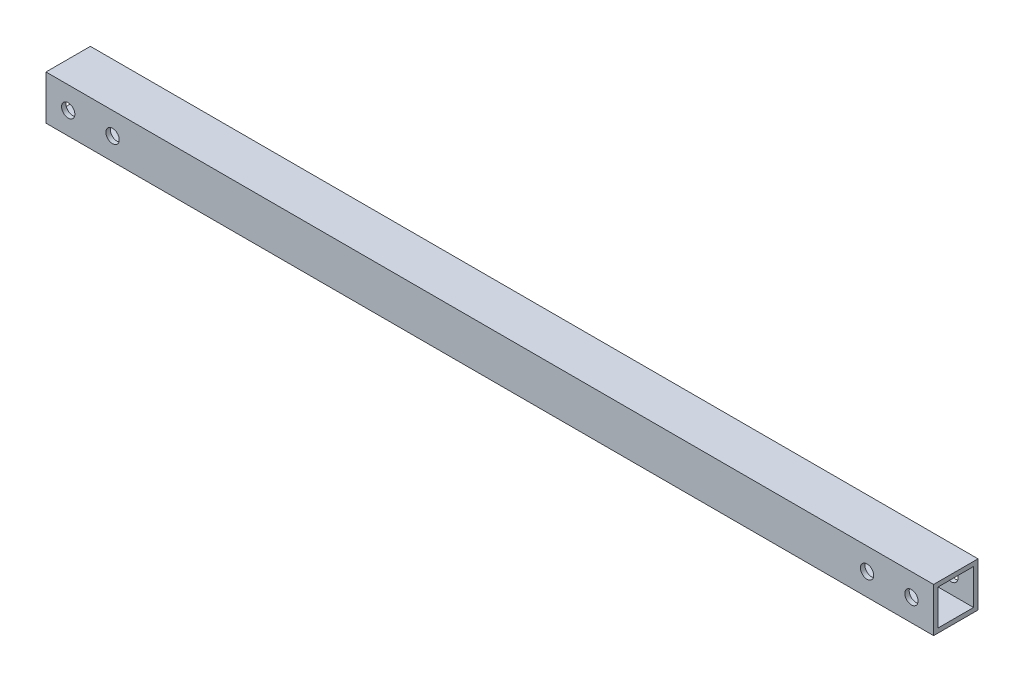
from build123d import *

# Parameters (mm, degrees)
SKETCH1_W           = 20
SKETCH1_H           = 20
SKETCH1_W_2         = 16
SKETCH1_H_2         = 16
BOSS_EXTRUDE1_DEPTH = 200
SKETCH2_R           = 3
CUT_EXTRUDE1_DEPTH  = 202.246117975


with BuildPart() as part:
    # Sketch1 → Boss-Extrude1 (new, symmetric)
    with BuildSketch(Plane(origin=(0, 0, 0), x_dir=(0, 0, -1), z_dir=(1, 0, 0))):
        Rectangle(SKETCH1_W, SKETCH1_H)
        Rectangle(SKETCH1_W_2, SKETCH1_H_2, mode=Mode.SUBTRACT)
    extrude(amount=BOSS_EXTRUDE1_DEPTH, both=True)

    # Sketch2 → Cut-Extrude1 (cut, through all)
    with BuildSketch(Plane.XY.offset(10)):
        with Locations((190, 0)):
            Circle(SKETCH2_R)
        with Locations((170, 0)):
            Circle(SKETCH2_R)
        with Locations((-170, 0)):
            Circle(SKETCH2_R)
        with Locations((-190, 0)):
            Circle(SKETCH2_R)
    extrude(amount=-CUT_EXTRUDE1_DEPTH, mode=Mode.SUBTRACT)


solid = part.part
